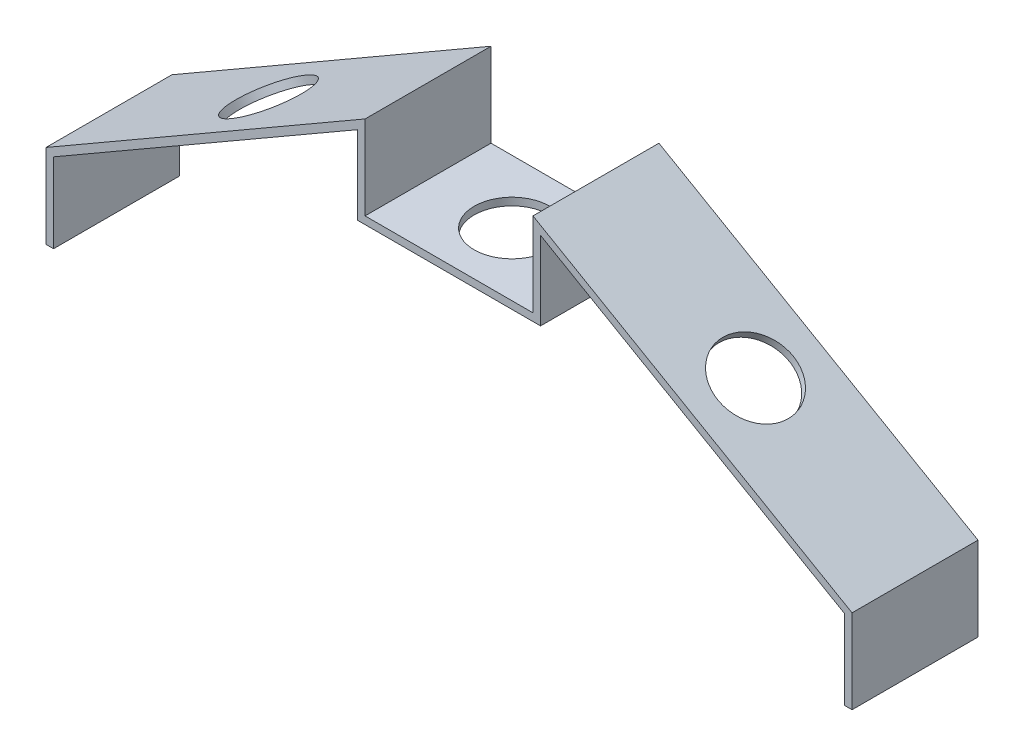
from build123d import *

# Parameters (mm, degrees)
SALIENTE_EXTRUIR1_DEPTH = 30
CROQUIS2_R              = 9
CORTAR_EXTRUIR1_DEPTH   = 110.733009315
CROQUIS3_R              = 9
CORTAR_EXTRUIR2_DEPTH   = 30
CROQUIS4_R              = 9
CORTAR_EXTRUIR3_DEPTH   = 30


with BuildPart() as part:
    # Croquis1 → Saliente-Extruir1 (new body)
    with BuildSketch(Plane.XY):
        Polygon((-20, 0), (20, 0), (20, 20), (96, -23.878620458), (96, -43.878620458), (94.2, -43.878620458), (94.2, -24.917850943), (21.8, 16.882308546), (21.8, -1.8), (-21.8, -1.8), (-21.8, 16.882308546), (-94.2, -24.917850943), (-94.2, -43.878620458), (-96, -43.878620458), (-96, -23.878620458), (-20, 20), align=None)
    extrude(amount=SALIENTE_EXTRUIR1_DEPTH)

    # Croquis2 → Cortar-Extruir1 (cut, through all)
    with BuildSketch(Plane(origin=(0, 0, 0), x_dir=(1, 0, 0), z_dir=(0, 1, 0))):
        with Locations(Location((0, -15, 0), (0, 0, 180))):
            Circle(CROQUIS2_R)
    extrude(amount=-CORTAR_EXTRUIR1_DEPTH, mode=Mode.SUBTRACT)

    # Croquis3 → Cortar-Extruir2 (cut)
    with BuildSketch(Plane(origin=(13.660254038, 23.660254038, 0), x_dir=(0.866025403784438, -0.5000000000000012, 0), z_dir=(0.5000000000000012, 0.866025403784438, 0))):
        with Locations(Location((51.199128534, -15, 0), (0, 0, 180))):
            Circle(CROQUIS3_R)
    extrude(amount=-CORTAR_EXTRUIR2_DEPTH, mode=Mode.SUBTRACT)

    # Croquis4 → Cortar-Extruir3 (cut)
    with BuildSketch(Plane(origin=(-13.660254038, 23.660254038, 0), x_dir=(0.8660254037844378, 0.5000000000000017, 0), z_dir=(-0.5000000000000016, 0.8660254037844377, 0))):
        with Locations(Location((-51.199128534, -15, 0), (0, 0, 180))):
            Circle(CROQUIS4_R)
    extrude(amount=-CORTAR_EXTRUIR3_DEPTH, mode=Mode.SUBTRACT)


solid = part.part
